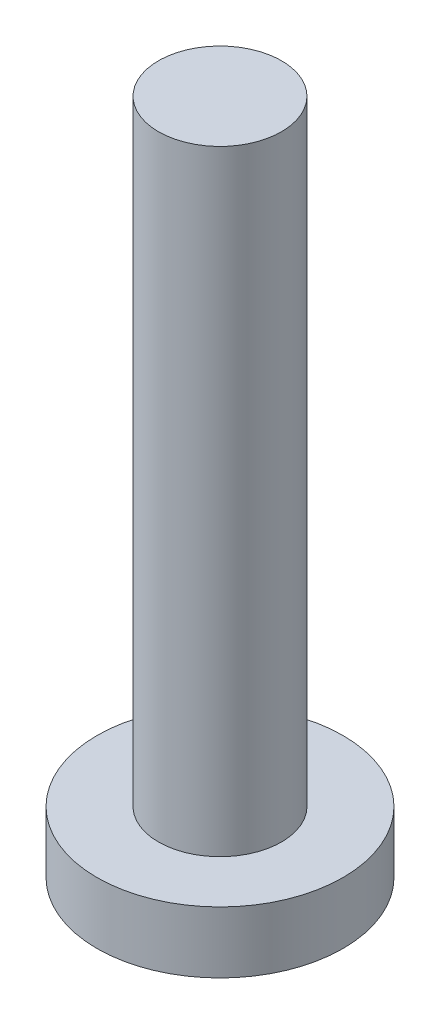
from build123d import *

# Parameters (mm, degrees)
SKIZZE1_R                       = 10
AUFSATZ_LINEAR_AUSTRAGEN1_DEPTH = 5
SKIZZE2_R                       = 5
AUFSATZ_LINEAR_AUSTRAGEN2_DEPTH = 50


with BuildPart() as part:
    # Skizze1 → Aufsatz-Linear austragen1 (new body)
    with BuildSketch(Plane(origin=(0, 0, 0), x_dir=(1, 0, 0), z_dir=(0, 1, 0))):
        with Locations(Location((0, 0, 0), (0, 0, 270))):
            Circle(SKIZZE1_R)
    extrude(amount=AUFSATZ_LINEAR_AUSTRAGEN1_DEPTH)

    # Skizze2 → Aufsatz-Linear austragen2 (add)
    with BuildSketch(Plane(origin=(0, 5, 0), x_dir=(1, 0, 0), z_dir=(0, 1, 0))):
        with Locations(Location((0, 0, 0), (0, 0, 270))):
            Circle(SKIZZE2_R)
    extrude(amount=AUFSATZ_LINEAR_AUSTRAGEN2_DEPTH)


solid = part.part
